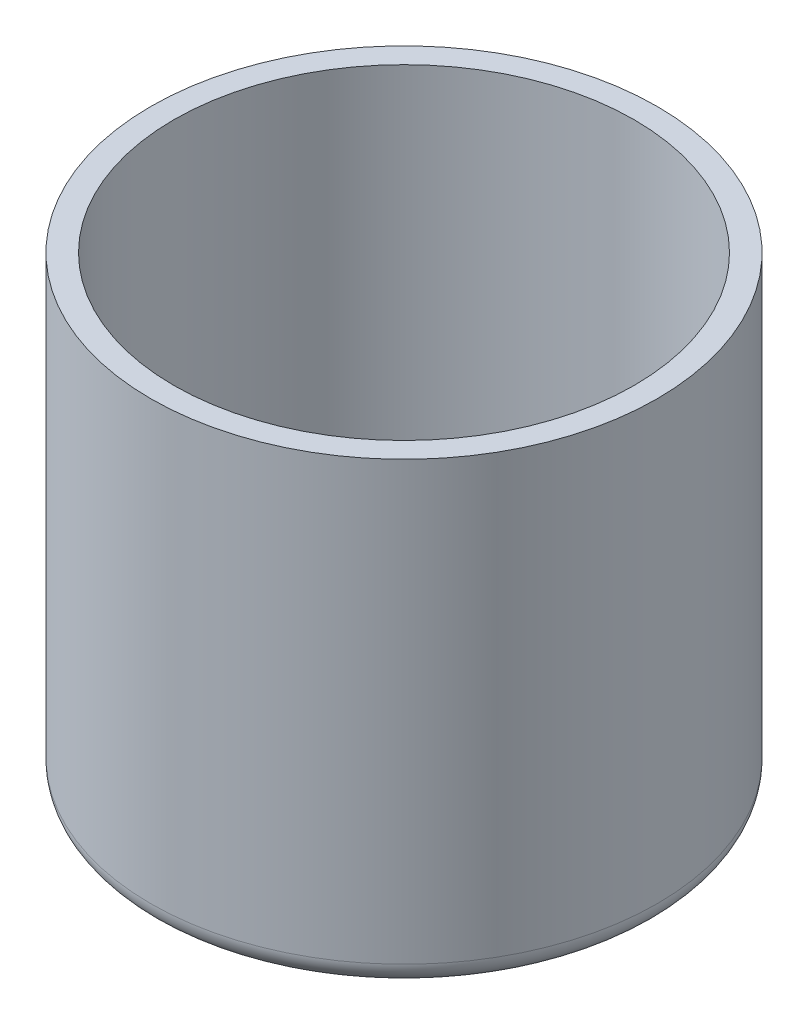
from build123d import *

# Parameters (mm, degrees)
SKETCH1_R           = 11
BOSS_EXTRUDE1_DEPTH = 20
SKETCH2_R           = 10
CUT_EXTRUDE1_DEPTH  = 18
FILLET1_R           = 1
CUT_EXTRUDE2_REACH  = 27.338
SKETCH3_R           = 4


with BuildPart() as part:
    # Sketch1 → Boss-Extrude1 (new body)
    with BuildSketch(Plane(origin=(0, 0, 0), x_dir=(1, 0, 0), z_dir=(0, 1, 0))):
        with Locations(Location((0, 0, 0), (0, 0, 270))):
            Circle(SKETCH1_R)
    extrude(amount=BOSS_EXTRUDE1_DEPTH)

    # Sketch2 → Cut-Extrude1 (cut)
    with BuildSketch(Plane(origin=(0, 20, 0), x_dir=(1, 0, 0), z_dir=(0, 1, 0))):
        with Locations(Location((0, 0, 0), (0, 0, 270))):
            Circle(SKETCH2_R)
    extrude(amount=-CUT_EXTRUDE1_DEPTH, mode=Mode.SUBTRACT)

    # Fillet1
    fillet1_edges = [part.edges().sort_by_distance(p)[0] for p in [
        (0, 0, -11),
    ]]
    fillet(fillet1_edges, radius=FILLET1_R)

    # Sketch3 → Cut-Extrude2 (cut, up to next)
    with BuildSketch(Plane.XZ, mode=Mode.PRIVATE) as cut_extrude2_sk1:
        with Locations(Location((0, 0, 0), (0, 0, 270))):
            Circle(SKETCH3_R)
    cut_extrude2_tool1 = extrude(cut_extrude2_sk1.sketch, amount=-CUT_EXTRUDE2_REACH, mode=Mode.PRIVATE) & part.part
    add(cut_extrude2_tool1.solids().sort_by_distance((0, 0, 0))[0], mode=Mode.SUBTRACT)


solid = part.part
